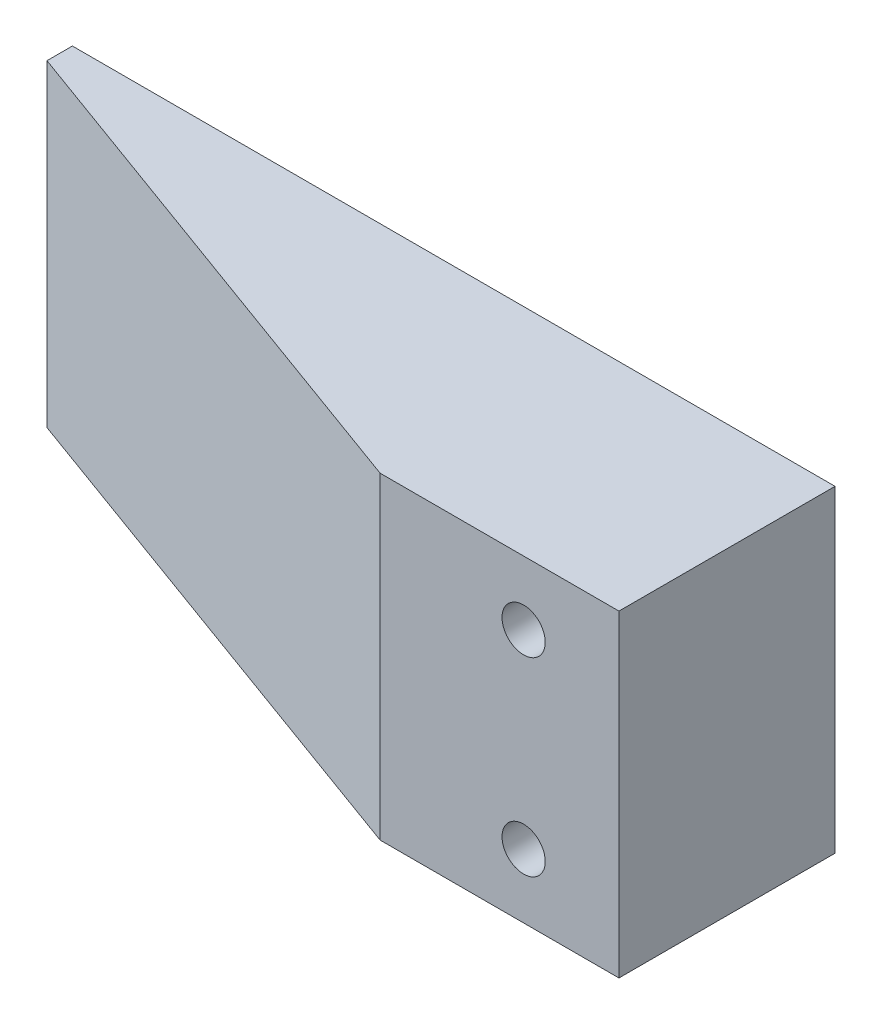
from build123d import *

# Parameters (mm, degrees)
BOSS_EXTRUDE1_DEPTH      = 8.5
BOSS_EXTRUDE1_DEPTH_BACK = 8.5
SKETCH2_R                = 1.7
CHAMFER1_SIZE            = 15
CHAMFER1_SIZE2           = 41.212161292


with BuildPart() as part:
    # Sketch2 → Boss-Extrude1 (new, two sides: drawn at the far end of the back side and taken through both)
    with BuildSketch(Plane.XY.offset(-BOSS_EXTRUDE1_DEPTH_BACK)):
        Polygon((-7.5, 12.5), (7.5, 12.5), (7.5, -12.5), (-7.5, -12.5), (-52.5, -12.5), (-52.5, 12.5), align=None)
        with Locations((0, 7.466666667)):
            Circle(SKETCH2_R, mode=Mode.SUBTRACT)
        with Locations((0, -7.466666667)):
            Circle(SKETCH2_R, mode=Mode.SUBTRACT)
    extrude(amount=BOSS_EXTRUDE1_DEPTH + BOSS_EXTRUDE1_DEPTH_BACK)

    # Chamfer1
    chamfer1_edges = [part.edges().sort_by_distance(p)[0] for p in [
        (-52.5, 0, 8.5),
    ]]
    chamfer1_side = [part.faces().sort_by_distance(p)[0] for p in [
        (-52.5, 0, 0),
    ]]
    chamfer(chamfer1_edges, length=CHAMFER1_SIZE, length2=CHAMFER1_SIZE2, reference=chamfer1_side[0])


solid = part.part
